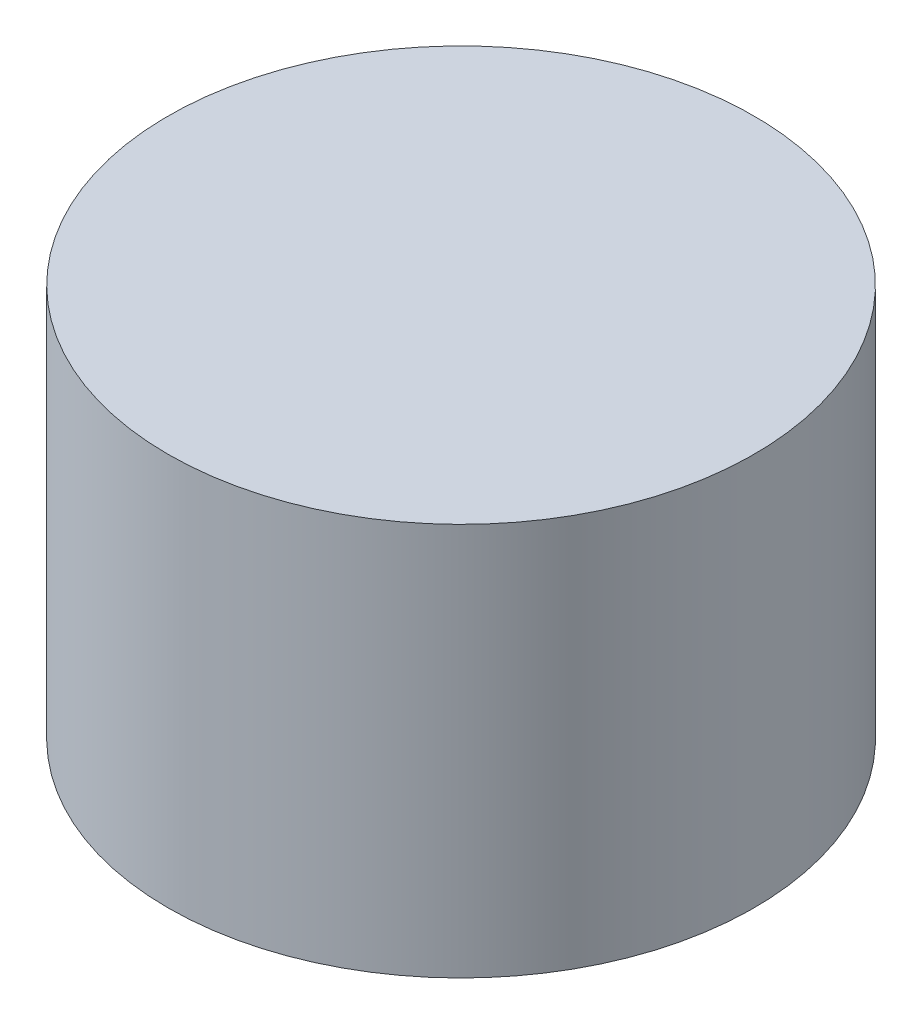
from build123d import *

# Parameters (mm, degrees)
SKETCH1_R           = 8.95
BOSS_EXTRUDE1_DEPTH = 12


with BuildPart() as part:
    # Sketch1 → Boss-Extrude1 (new body)
    with BuildSketch(Plane(origin=(0, 0, 0), x_dir=(1, 0, 0), z_dir=(0, 1, 0))):
        with Locations(Location((0, 0, 0), (0, 0, 270))):
            Circle(SKETCH1_R)
    extrude(amount=BOSS_EXTRUDE1_DEPTH)


solid = part.part
